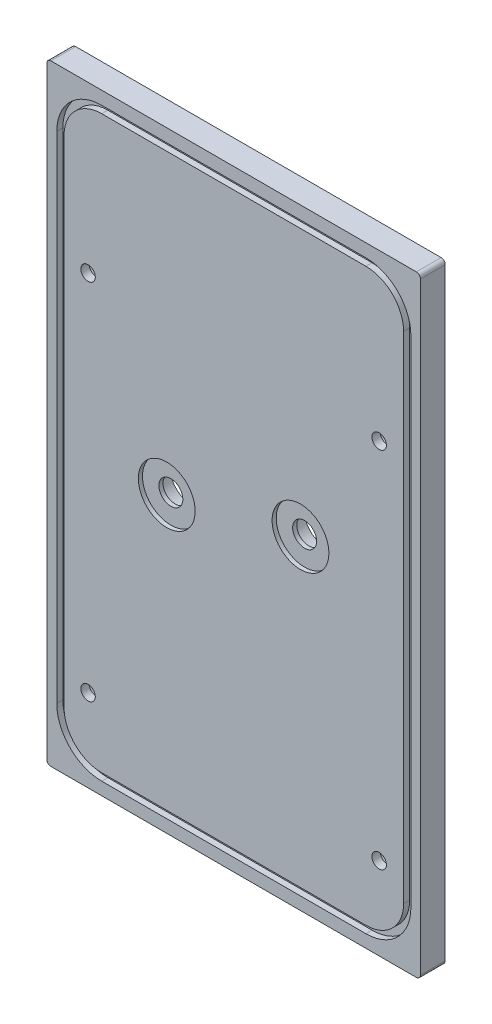
from build123d import *

# Parameters (mm, degrees)
ESBO_O1_W                                           = 181
ESBO_O1_H                                           = 296
RESSALTO_EXTRUS_O1_DEPTH                            = 12
FILETE1_R                                           = 2
FILETE2_R                                           = 2
ESBO_O4_W                                           = 3.53
ESBO_O4_H                                           = 3.53
REBAIXO_PARA_PARAFUSO_COM_CABE_A_PANELA_D           = 7
REBAIXO_PARA_PARAFUSO_COM_CABE_A_PANELA_CBORE_D     = 13
REBAIXO_PARA_PARAFUSO_COM_CABE_A_PANELA_CBORE_DEPTH = 8
CORTE_EXTRUS_O1_REACH                               = 175.891
ESBO_O9_R                                           = 5.8
ESBO_O10_R                                          = 10.275
CORTE_EXTRUS_O2_DEPTH                               = 8
ESBO_O11_R                                          = 13.75
CORTE_EXTRUS_O3_DEPTH                               = 2
CORTE_EXTRUS_O4_DEPTH                               = 1.4
CORTE_EXTRUS_O5_DEPTH                               = 1.4


with BuildPart() as part:
    # Esboço1 → Ressalto-extrusão1 (new body)
    with BuildSketch(Plane.XY):
        Rectangle(ESBO_O1_W, ESBO_O1_H)
    extrude(amount=RESSALTO_EXTRUS_O1_DEPTH)

    # Filete1
    filete1_edges = [part.edges().sort_by_distance(p)[0] for p in [
        (-90.5, 148, 6),
    ]]
    fillet(filete1_edges, radius=FILETE1_R)

    # Filete2
    filete2_edges = [part.edges().sort_by_distance(p)[0] for p in [
        (90.5, -148, 6),
        (-90.5, -148, 6),
        (90.5, 148, 6),
    ]]
    fillet(filete2_edges, radius=FILETE2_R)

    # Varredura de corte1: sweep along a path in Esboço2
    with BuildLine(Plane.XY.offset(12)) as varredura_de_corte1_path:
        Line((-63.9, -140.1), (64.1, -140.1))
        ThreePointArc((64.1, -140.1), (78.242135624, -134.242135624), (84.1, -120.1))
        Line((84.1, -120.1), (84.1, 119.9))
        ThreePointArc((84.1, 119.9), (78.242135624, 134.042135624), (64.1, 139.9))
        Line((64.1, 139.9), (-63.9, 139.9))
        ThreePointArc((-63.9, 139.9), (-78.042135624, 134.042135624), (-83.9, 119.9))
        Line((-83.9, 119.9), (-83.9, -120.1))
        ThreePointArc((-83.9, -120.1), (-78.042135624, -134.242135624), (-63.9, -140.1))
    # Esboço4 → Varredura de corte1 (sweep, cut)
    with BuildSketch(Plane(origin=(0, 0, 0), x_dir=(1, 0, 0), z_dir=(0, 1, 0))):
        with Locations((-83.9, -10.8)):
            Rectangle(ESBO_O4_W, ESBO_O4_H)
    sweep(path=varredura_de_corte1_path.line, mode=Mode.SUBTRACT)

    # Rebaixo para parafuso com cabeça panela de M61 (through all)
    with Locations(Plane(origin=(0, 0, 0), x_dir=(-1, 0, 0), z_dir=(0, 0, -1))):
        with Locations((-70.5, 68), (70.5, 68), (70.5, -108), (-70.5, -108)):
            CounterBoreHole(REBAIXO_PARA_PARAFUSO_COM_CABE_A_PANELA_D / 2, REBAIXO_PARA_PARAFUSO_COM_CABE_A_PANELA_CBORE_D / 2, REBAIXO_PARA_PARAFUSO_COM_CABE_A_PANELA_CBORE_DEPTH)

    # Esboço9 → Corte-extrusão1 (cut, up to next)
    with BuildSketch(Plane(origin=(0, 0, 0), x_dir=(-1, 0, 0), z_dir=(0, 0, -1)), mode=Mode.PRIVATE) as corte_extrus_o1_sk1:
        with Locations((32.4, -6)):
            Circle(ESBO_O9_R)
    corte_extrus_o1_tool1 = extrude(corte_extrus_o1_sk1.sketch, amount=-CORTE_EXTRUS_O1_REACH, mode=Mode.PRIVATE) & part.part
    # Esboço9 → Corte-extrusão1 (cut, up to next)
    with BuildSketch(Plane(origin=(0, 0, 0), x_dir=(-1, 0, 0), z_dir=(0, 0, -1)), mode=Mode.PRIVATE) as corte_extrus_o1_sk2:
        with Locations((-32.4, 8.8)):
            Circle(ESBO_O9_R)
    corte_extrus_o1_tool2 = extrude(corte_extrus_o1_sk2.sketch, amount=-CORTE_EXTRUS_O1_REACH, mode=Mode.PRIVATE) & part.part
    add(corte_extrus_o1_tool1.solids().sort_by_distance((-32.4, -6, 0))[0], mode=Mode.SUBTRACT)
    add(corte_extrus_o1_tool2.solids().sort_by_distance((32.4, 8.8, 0))[0], mode=Mode.SUBTRACT)

    # Esboço10 → Corte-extrusão2 (cut)
    with BuildSketch(Plane(origin=(0, 0, 0), x_dir=(-1, 0, 0), z_dir=(0, 0, -1))):
        with Locations((32.4, -6)):
            Circle(ESBO_O10_R)
        with Locations((-32.4, 8.8)):
            Circle(ESBO_O10_R)
    extrude(amount=-CORTE_EXTRUS_O2_DEPTH, mode=Mode.SUBTRACT)

    # Esboço11 → Corte-extrusão3 (cut)
    with BuildSketch(Plane.XY.offset(12)):
        with Locations((32.4, 8.8)):
            Circle(ESBO_O11_R)
        with Locations((-32.4, -6)):
            Circle(ESBO_O11_R)
    extrude(amount=-CORTE_EXTRUS_O3_DEPTH, mode=Mode.SUBTRACT)

    # Esboço12 → Corte-extrusão4 (cut)
    with BuildSketch(Plane(origin=(0, 0, 0), x_dir=(-1, 0, 0), z_dir=(0, 0, -1))):
        with BuildLine():
            Line((-33.4, 19.075), (-33.4, 25.075))
            ThreePointArc((-33.4, 25.075), (-32.4, 26.075), (-31.4, 25.075))
            Line((-31.4, 25.075), (-31.4, 19.075))
            ThreePointArc((-31.4, 19.075), (-32.4, 18.075), (-33.4, 19.075))
        make_face()
    extrude(amount=-CORTE_EXTRUS_O4_DEPTH, mode=Mode.SUBTRACT)

    # Esboço13 → Corte-extrusão5 (cut)
    with BuildSketch(Plane(origin=(0, 0, 0), x_dir=(-1, 0, 0), z_dir=(0, 0, -1))):
        with BuildLine():
            Line((31.4, 4.275), (31.4, 9.275))
            ThreePointArc((31.4, 9.275), (32.4, 10.275), (33.4, 9.275))
            Line((33.4, 9.275), (33.4, 4.275))
            ThreePointArc((33.4, 4.275), (32.4, 3.275), (31.4, 4.275))
        make_face()
    extrude(amount=-CORTE_EXTRUS_O5_DEPTH, mode=Mode.SUBTRACT)


solid = part.part
